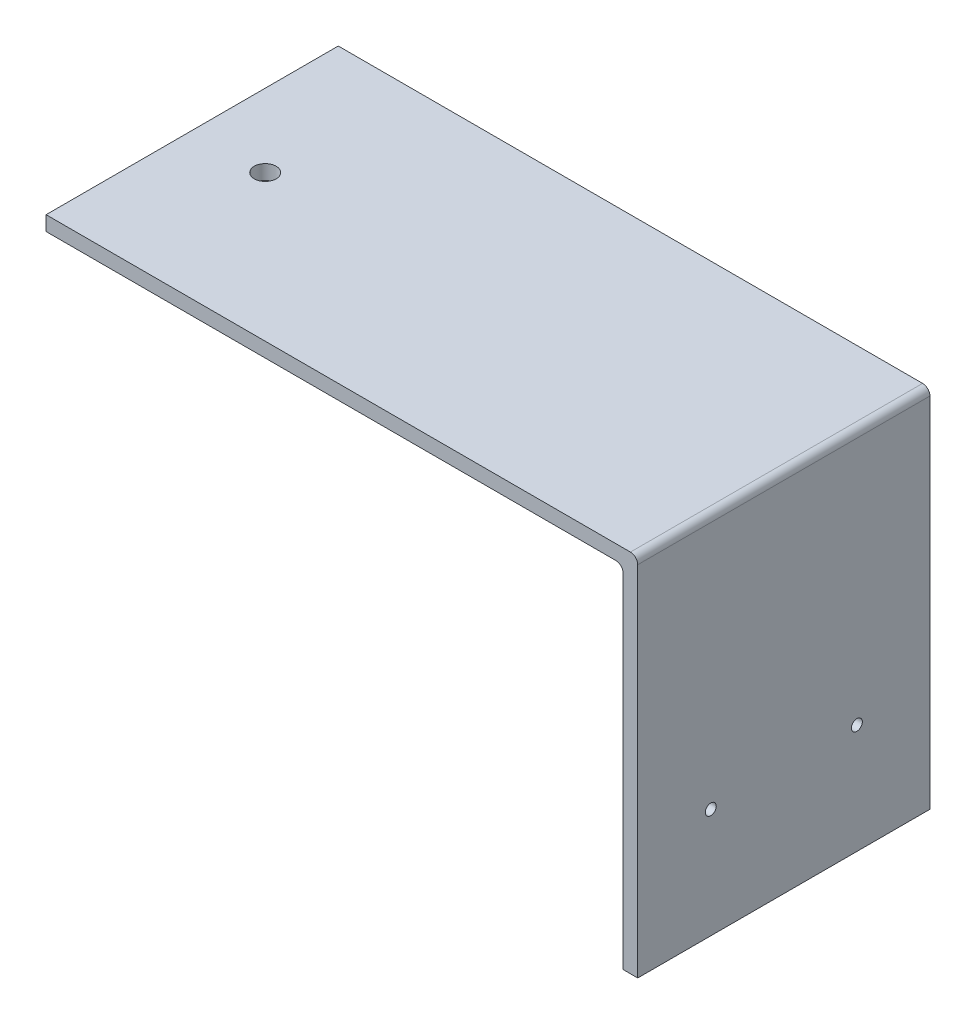
from build123d import *

# Parameters (mm, degrees)
SKETCH1_W           = 80
SKETCH1_H           = 40
SKETCH1_R           = 1.5
BOSS_EXTRUDE1_DEPTH = 2
SKETCH2_W           = 1
SKETCH2_H           = 40
BOSS_EXTRUDE2_DEPTH = 50
SKETCH3_R           = 0.75
CUT_EXTRUDE1_DEPTH  = 70
FILLET1_R           = 1


with BuildPart() as part:
    # Sketch1 → Boss-Extrude1 (new body)
    with BuildSketch(Plane(origin=(0, 0, 0), x_dir=(1, 0, 0), z_dir=(0, 1, 0))):
        with Locations((40, 20)):
            Rectangle(SKETCH1_W, SKETCH1_H)
        with Locations(Location((10, 20, 0), (0, 0, 270))):
            Circle(SKETCH1_R, mode=Mode.SUBTRACT)
    extrude(amount=BOSS_EXTRUDE1_DEPTH)

    # Sketch2 → Boss-Extrude2 (add)
    with BuildSketch(Plane(origin=(0, 2, 0), x_dir=(1, 0, 0), z_dir=(0, 1, 0))):
        with Locations((79.5, 20)):
            Rectangle(SKETCH2_W, SKETCH2_H)
        with Locations((80.5, 20)):
            Rectangle(SKETCH2_W, SKETCH2_H)
    extrude(amount=-BOSS_EXTRUDE2_DEPTH)

    # Sketch3 → Cut-Extrude1 (cut)
    with BuildSketch(Plane.ZY.offset(-79)):
        with Locations((-30, -33)):
            Circle(SKETCH3_R)
        with Locations((-10, -33)):
            Circle(SKETCH3_R)
    extrude(amount=-CUT_EXTRUDE1_DEPTH, mode=Mode.SUBTRACT)

    # Fillet1
    fillet1_edges = [part.edges().sort_by_distance(p)[0] for p in [
        (79, 0, -20),
        (81, 2, -20),
    ]]
    fillet(fillet1_edges, radius=FILLET1_R)


solid = part.part
